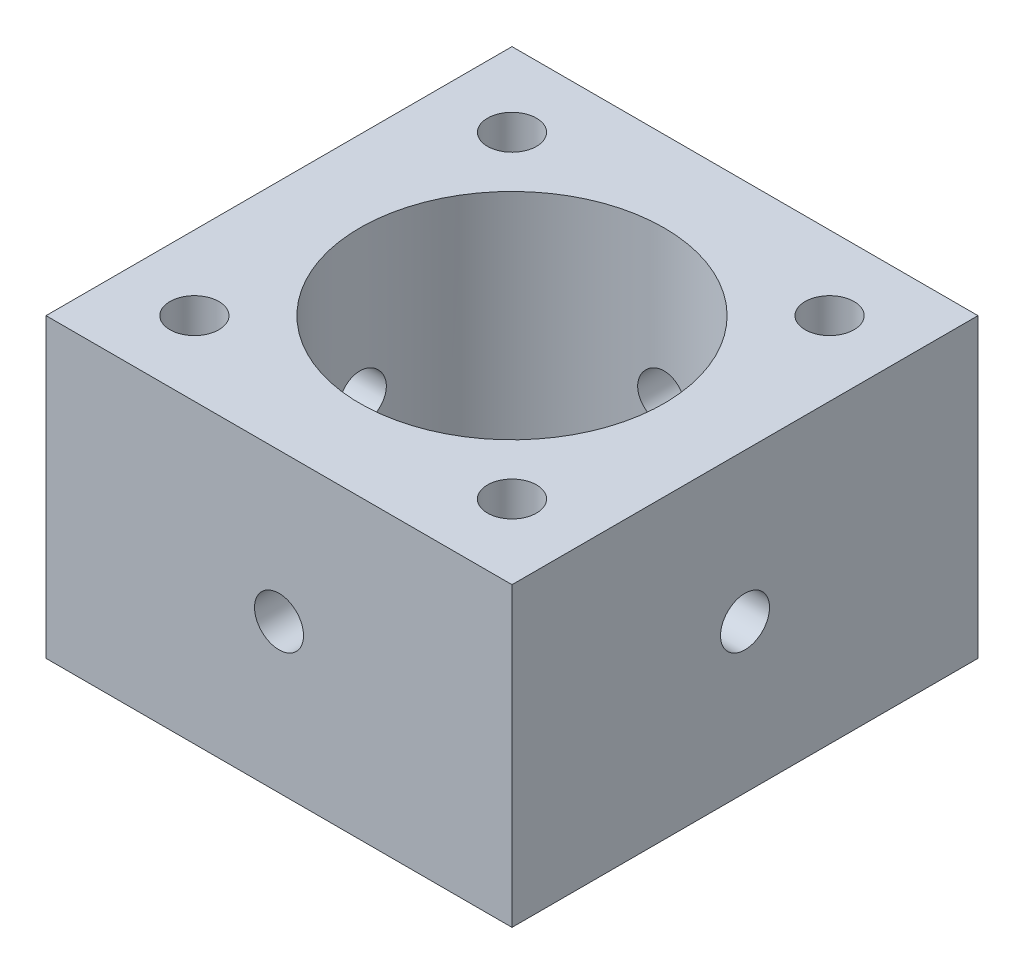
from build123d import *

# Parameters (mm, degrees)
SKETCH1_W                       = 31.4
SKETCH1_H                       = 31.4
SKETCH1_R                       = 10.25
BOSS_EXTRUDE1_DEPTH             = 40
SKETCH2_R                       = 1.5
CUT_EXTRUDE1_DEPTH              = 40
M4_TAPPED_HOLE1_D               = 3.3
M4_TAPPED_HOLE1_DEPTH           = 10.1
M4_TAPPED_HOLE1_TIP             = 0.991420021
M4_TAPPED_HOLE1_ON_FACE_2_D     = 3.3
M4_TAPPED_HOLE1_ON_FACE_2_DEPTH = 10.1
M4_TAPPED_HOLE1_ON_FACE_2_TIP   = 0.991420021
SKETCH5_R                       = 1.5
CUT_EXTRUDE2_DEPTH              = 40
M4_TAPPED_HOLE2_D               = 3.3
M4_TAPPED_HOLE2_DEPTH           = 10.1
M4_TAPPED_HOLE2_TIP             = 0.991420021
M4_TAPPED_HOLE2_ON_FACE_2_D     = 3.3
M4_TAPPED_HOLE2_ON_FACE_2_DEPTH = 10.1
M4_TAPPED_HOLE2_ON_FACE_2_TIP   = 0.991420021
SKETCH8_R                       = 1.5
CUT_EXTRUDE3_DEPTH              = 30
M4_TAPPED_HOLE3_D               = 3.3
M4_TAPPED_HOLE3_DEPTH           = 52.1
M4_TAPPED_HOLE3_TIP             = 0.991420021
SKETCH10_W                      = 31.4
SKETCH10_H                      = 20
CUT_EXTRUDE4_DEPTH              = 54.220766787


with BuildPart() as part:
    # Sketch1 → Boss-Extrude1 (new body)
    with BuildSketch(Plane(origin=(0, 0, 0), x_dir=(1, 0, 0), z_dir=(0, 1, 0))):
        Rectangle(SKETCH1_W, SKETCH1_H)
        with Locations(Location((0, 0, 0), (0, 0, 270))):
            Circle(SKETCH1_R, mode=Mode.SUBTRACT)
    extrude(amount=BOSS_EXTRUDE1_DEPTH)

    # Sketch2 → Cut-Extrude1 (cut)
    with BuildSketch(Plane(origin=(15.7, 0, 0), x_dir=(0, 0, -1), z_dir=(1, 0, 0))):
        with Locations((0, 30)):
            Circle(SKETCH2_R)
        with Locations((0, 10)):
            Circle(SKETCH2_R)
    extrude(amount=-CUT_EXTRUDE1_DEPTH, mode=Mode.SUBTRACT)

    # M4 Tapped Hole1
    with Locations(Plane(origin=(-15.7, 10, 0), x_dir=(0, 0, -1), z_dir=(-1, 0, 0))):
        with Locations((0, 0), (0, -20)):
            Hole(M4_TAPPED_HOLE1_D / 2, depth=M4_TAPPED_HOLE1_DEPTH)
            with Locations((0, 0, -(M4_TAPPED_HOLE1_DEPTH + M4_TAPPED_HOLE1_TIP / 2))):  # 118° drill point
                Cone(0, M4_TAPPED_HOLE1_D / 2, M4_TAPPED_HOLE1_TIP, mode=Mode.SUBTRACT)

    # M4 Tapped Hole1 on face 2
    with Locations(Plane(origin=(15.7, 30, 0), x_dir=(0, 0, -1), z_dir=(-1, 0, 0))):
        with Locations((0, 0), (0, 20)):
            Hole(M4_TAPPED_HOLE1_ON_FACE_2_D / 2, depth=M4_TAPPED_HOLE1_ON_FACE_2_DEPTH)
            with Locations((0, 0, -(M4_TAPPED_HOLE1_ON_FACE_2_DEPTH + M4_TAPPED_HOLE1_ON_FACE_2_TIP / 2))):  # 118° drill point
                Cone(0, M4_TAPPED_HOLE1_ON_FACE_2_D / 2, M4_TAPPED_HOLE1_ON_FACE_2_TIP, mode=Mode.SUBTRACT)

    # Sketch5 → Cut-Extrude2 (cut)
    with BuildSketch(Plane.XY.offset(15.7)):
        with Locations((0, 30)):
            Circle(SKETCH5_R)
        with Locations((0, 10)):
            Circle(SKETCH5_R)
    extrude(amount=-CUT_EXTRUDE2_DEPTH, mode=Mode.SUBTRACT)

    # M4 Tapped Hole2
    with Locations(Plane(origin=(0, 30, 15.7), x_dir=(1, 0, 0), z_dir=(0, 0, 1))):
        with Locations((0, 0), (0, -20)):
            Hole(M4_TAPPED_HOLE2_D / 2, depth=M4_TAPPED_HOLE2_DEPTH)
            with Locations((0, 0, -(M4_TAPPED_HOLE2_DEPTH + M4_TAPPED_HOLE2_TIP / 2))):  # 118° drill point
                Cone(0, M4_TAPPED_HOLE2_D / 2, M4_TAPPED_HOLE2_TIP, mode=Mode.SUBTRACT)

    # M4 Tapped Hole2 on face 2
    with Locations(Plane(origin=(0, 30, -15.7), x_dir=(1, 0, 0), z_dir=(0, 0, 1))):
        with Locations((0, 0), (0, -20)):
            Hole(M4_TAPPED_HOLE2_ON_FACE_2_D / 2, depth=M4_TAPPED_HOLE2_ON_FACE_2_DEPTH)
            with Locations((0, 0, -(M4_TAPPED_HOLE2_ON_FACE_2_DEPTH + M4_TAPPED_HOLE2_ON_FACE_2_TIP / 2))):  # 118° drill point
                Cone(0, M4_TAPPED_HOLE2_ON_FACE_2_D / 2, M4_TAPPED_HOLE2_ON_FACE_2_TIP, mode=Mode.SUBTRACT)

    # Sketch8 → Cut-Extrude3 (cut)
    with BuildSketch(Plane.XZ):
        with Locations(Location((-10.7, 10.7, 0), (0, 0, 270))):
            Circle(SKETCH8_R)
        with Locations(Location((10.7, 10.7, 0), (0, 0, 90))):
            Circle(SKETCH8_R)
        with Locations(Location((10.7, -10.7, 0), (0, 0, 270))):
            Circle(SKETCH8_R)
        with Locations(Location((-10.7, -10.7, 0), (0, 0, 90))):
            Circle(SKETCH8_R)
    extrude(amount=-CUT_EXTRUDE3_DEPTH, mode=Mode.SUBTRACT)

    # M4 Tapped Hole3
    with Locations(Plane(origin=(-10.7, 0, 10.7), x_dir=(0, 0, -1), z_dir=(0, -1, 0))):
        with Locations((0, 0), (0, 21.4), (21.4, 21.4), (21.4, 0)):
            Hole(M4_TAPPED_HOLE3_D / 2, depth=M4_TAPPED_HOLE3_DEPTH)
            with Locations((0, 0, -(M4_TAPPED_HOLE3_DEPTH + M4_TAPPED_HOLE3_TIP / 2))):  # 118° drill point
                Cone(0, M4_TAPPED_HOLE3_D / 2, M4_TAPPED_HOLE3_TIP, mode=Mode.SUBTRACT)

    # Sketch10 → Cut-Extrude4 (cut, through all)
    with BuildSketch(Plane.XY.offset(15.7)):
        with Locations((0, 30)):
            Rectangle(SKETCH10_W, SKETCH10_H)
    extrude(amount=-CUT_EXTRUDE4_DEPTH, mode=Mode.SUBTRACT)


solid = part.part
